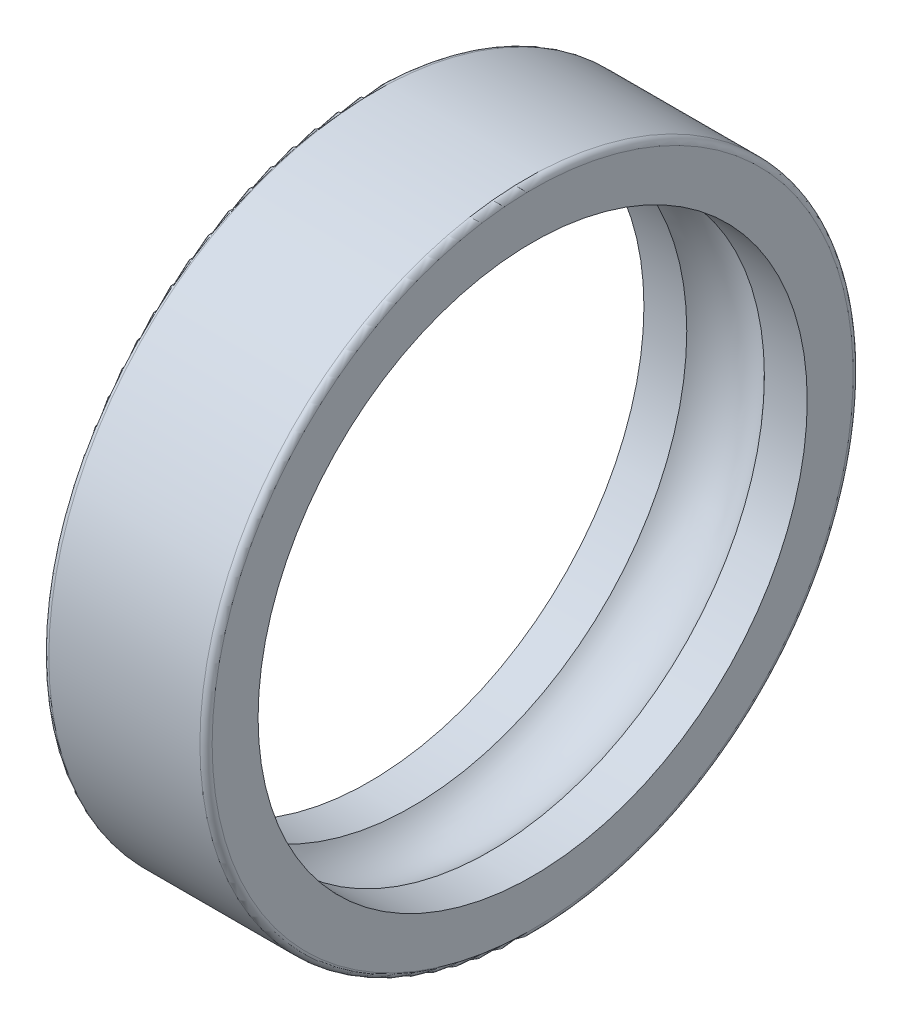
from build123d import *


with BuildPart() as part:
    # Esquisse1 → Base-Révolution (revolve)
    with BuildSketch(Plane(origin=(0, 0, 0), x_dir=(1, 0, 0), z_dir=(0, 1, 0))):
        with BuildLine():
            Line((0, 15.7), (0, 13.45))
            Line((0, 13.45), (2.099342219, 13.45))
            ThreePointArc((2.099342219, 13.45), (4, 14.3), (5.900657781, 13.45))
            Line((5.900657781, 13.45), (8, 13.45))
            Line((8, 13.45), (8, 15.7))
            ThreePointArc((8, 15.7), (7.912132034, 15.912132034), (7.7, 16))
            Line((7.7, 16), (0.3, 16))
            ThreePointArc((0.3, 16), (0.087867966, 15.912132034), (0, 15.7))
        make_face()
    revolve(axis=Axis((0, 0, 0), (1, 0, 0)))


solid = part.part
